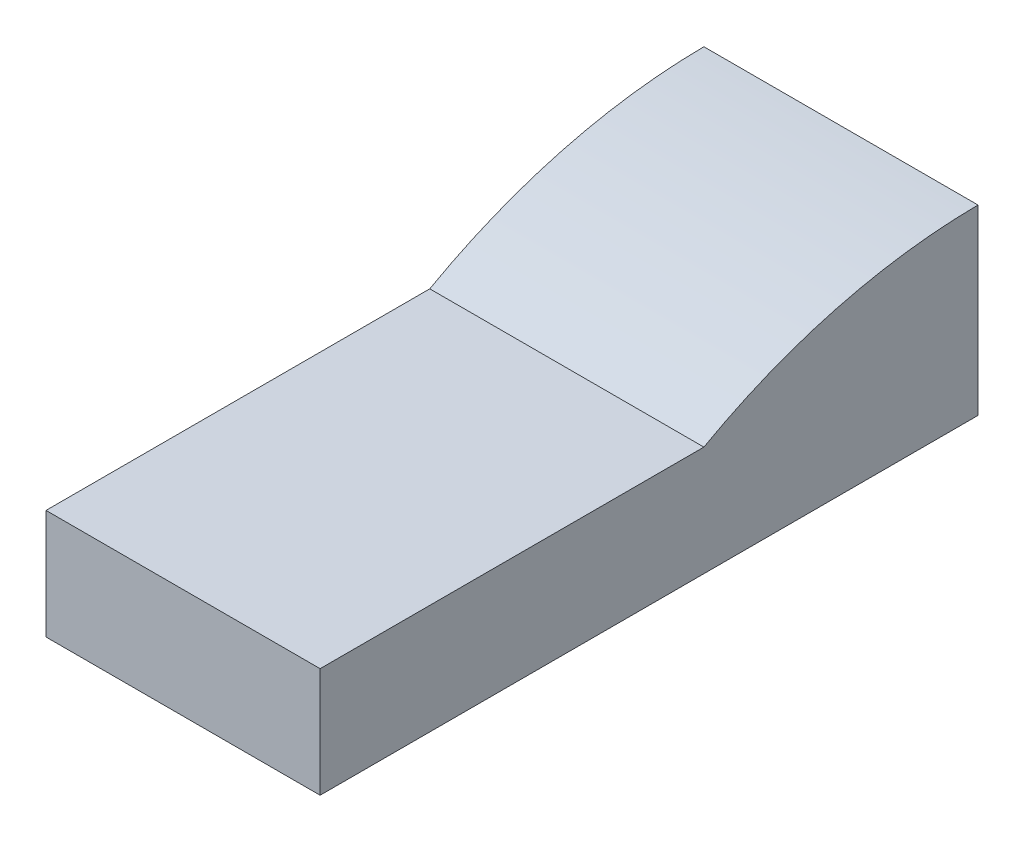
from build123d import *

# Parameters (mm, degrees)
BOSS_EXTRUDE1_DEPTH = 12.7


with BuildPart() as part:
    # Sketch1 → Boss-Extrude1 (new body)
    with BuildSketch(Plane(origin=(0, 0, 0), x_dir=(0, 0, -1), z_dir=(1, 0, 0))):
        with BuildLine():
            ThreePointArc((0, 1.905), (6.13739758, 4.389610207), (12.7, 5.268920391))
            Line((12.7, 5.268920391), (12.7, 1.905))
            Line((12.7, 1.905), (12.7, -3.175))
            Line((12.7, -3.175), (-17.78, -3.175))
            Line((-17.78, -3.175), (-17.78, 1.905))
            Line((-17.78, 1.905), (0, 1.905))
        make_face()
    extrude(amount=BOSS_EXTRUDE1_DEPTH)


solid = part.part
